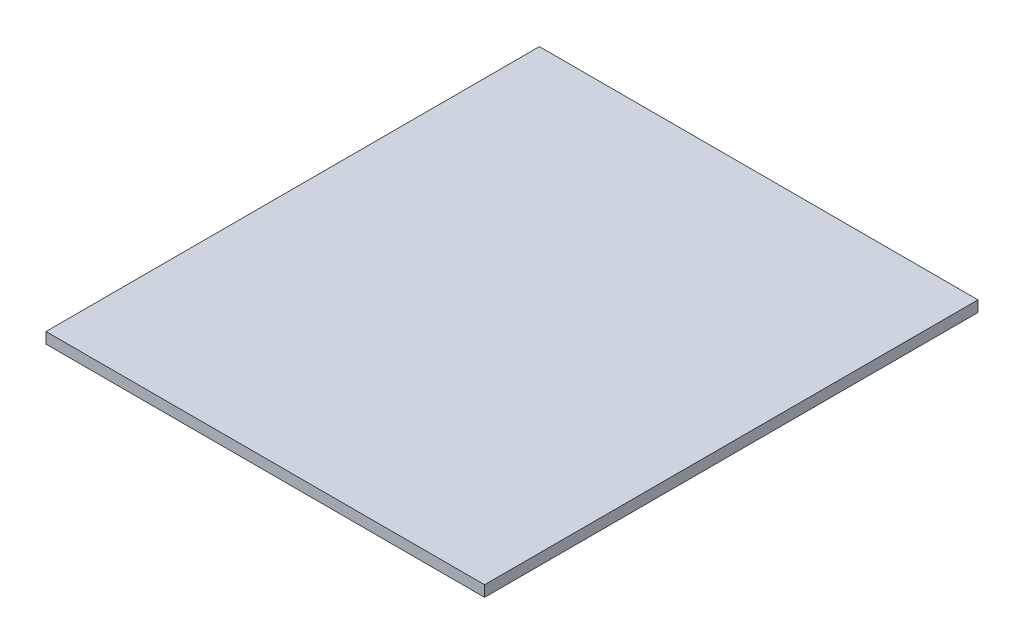
from build123d import *

# Parameters (mm, degrees)
SKETCH1_W           = 400
SKETCH1_H           = 450
BOSS_EXTRUDE1_DEPTH = 10


with BuildPart() as part:
    # Sketch1 → Boss-Extrude1 (new body)
    with BuildSketch(Plane(origin=(0, 0, 0), x_dir=(1, 0, 0), z_dir=(0, 1, 0))):
        Rectangle(SKETCH1_W, SKETCH1_H)
    extrude(amount=BOSS_EXTRUDE1_DEPTH)


solid = part.part
